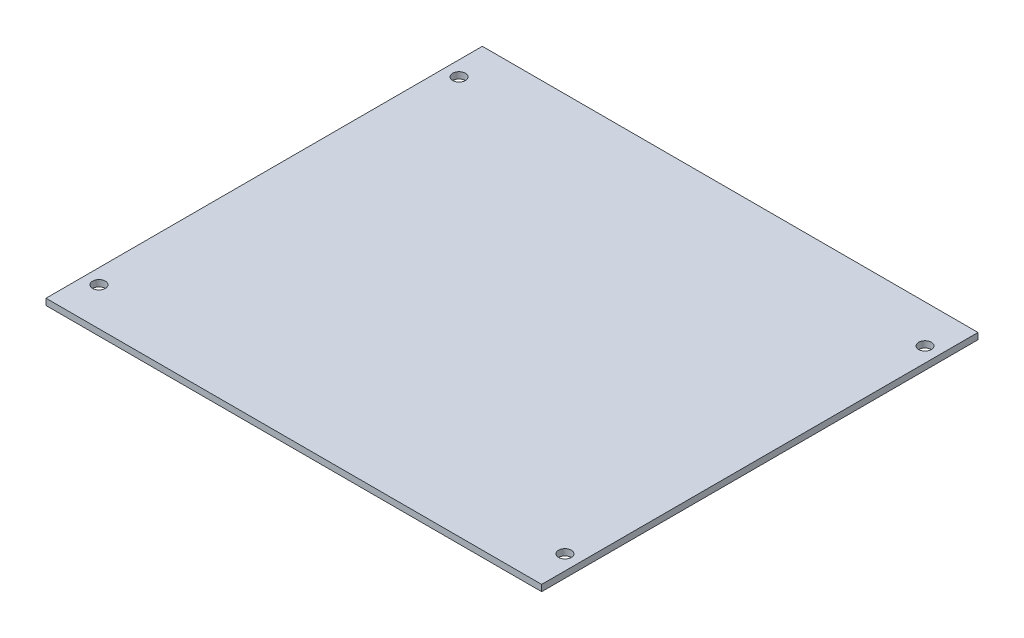
from build123d import *

# Parameters (mm, degrees)
SKETCH_1_W      = 117
SKETCH_1_H      = 103
SKETCH_1_R      = 1.5
EXTRUDE_1_DEPTH = 1.5


with BuildPart() as part:
    # Эскиз1 → Бобышка-Вытянуть1 (new body)
    with BuildSketch(Plane(origin=(0, 0, 0), x_dir=(1, 0, 0), z_dir=(0, 1, 0))):
        Rectangle(SKETCH_1_W, SKETCH_1_H)
        with Locations(Location((-55, 42.5, 0), (0, 0, 270))):
            Circle(SKETCH_1_R, mode=Mode.SUBTRACT)
        with Locations(Location((55, 42.5, 0), (0, 0, 270))):
            Circle(SKETCH_1_R, mode=Mode.SUBTRACT)
        with Locations(Location((55, -42.5, 0), (0, 0, 270))):
            Circle(SKETCH_1_R, mode=Mode.SUBTRACT)
        with Locations(Location((-55, -42.5, 0), (0, 0, 270))):
            Circle(SKETCH_1_R, mode=Mode.SUBTRACT)
    extrude(amount=EXTRUDE_1_DEPTH)


solid = part.part
